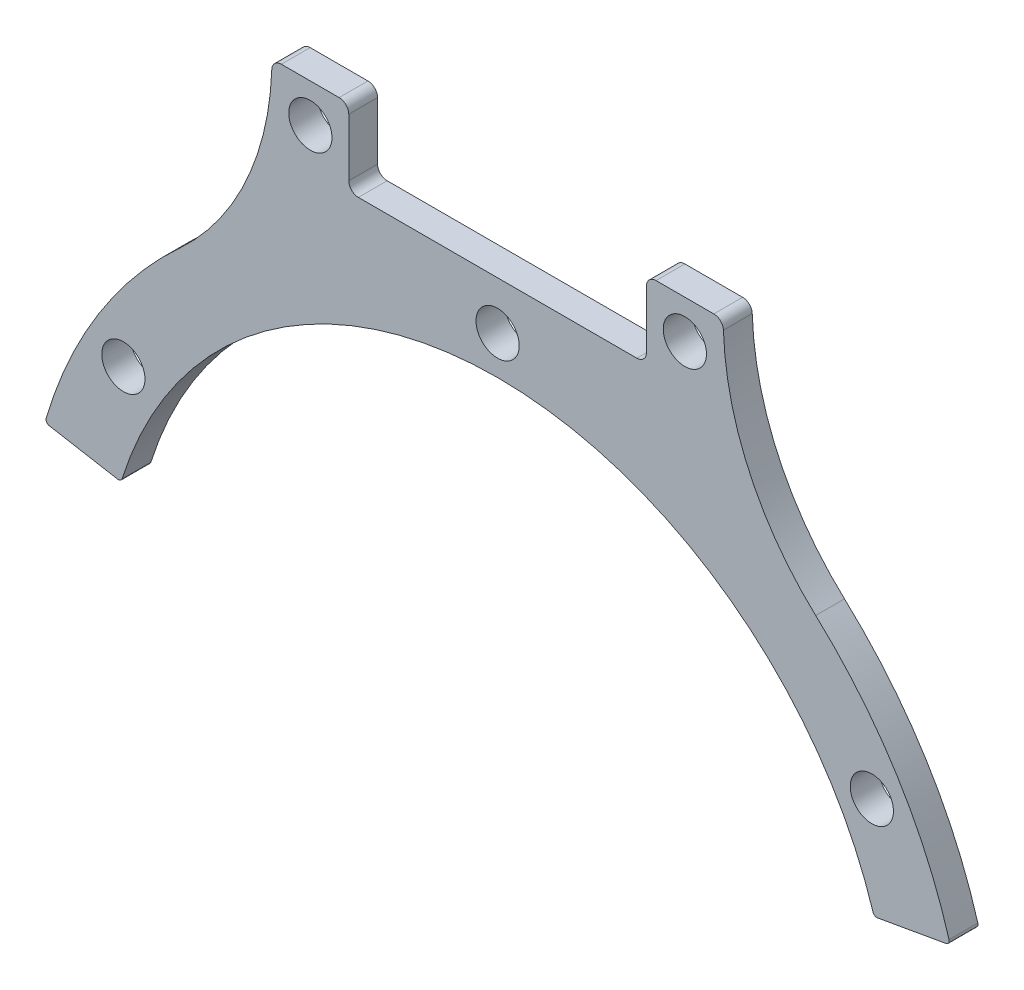
from build123d import *

# Parameters (mm, degrees)
SKETCH_1_R      = 2.25
EXTRUDE_1_DEPTH = 3


with BuildPart() as part:
    # 草图1 → 凸台-拉伸1 (new body)
    with BuildSketch(Plane(origin=(0, 0, 0), x_dir=(-1, 0, 0), z_dir=(0, 0, -1))):
        with BuildLine():
            Line((-46.697056051, -46.688916039), (-39.554488655, -47.948343383))
            ThreePointArc((-39.554488655, -47.948343383), (-39.277504317, -47.896375463), (-39.103531516, -47.674667428))
            ThreePointArc((-39.103531516, -47.674667428), (0, -19), (39.103531516, -47.674667428))
            ThreePointArc((39.103531516, -47.674667428), (39.277504317, -47.896375463), (39.554488655, -47.948343383))
            Line((39.554488655, -47.948343383), (46.697056051, -46.688916039))
            ThreePointArc((46.697056051, -46.688916039), (46.967515904, -46.505836455), (47.011363008, -46.182194526))
            ThreePointArc((47.011363008, -46.182194526), (41.589384656, -34.090096798), (33.125428162, -23.893130722))
            ThreePointArc((33.125428162, -23.893130722), (26.210916767, -14.399107105), (23.515754966, -2.967438148))
            ThreePointArc((23.515754966, -2.967438148), (23.211784398, -2.281473086), (22.516285244, -2))
            Line((22.516285244, -2), (16.5, -2))
            ThreePointArc((16.5, -2), (15.792893219, -2.292893219), (15.5, -3))
            Line((15.5, -3), (15.5, -9))
            ThreePointArc((15.5, -9), (15.207106781, -9.707106781), (14.5, -10))
            Line((14.5, -10), (-14.5, -10))
            ThreePointArc((-14.5, -10), (-15.207106781, -9.707106781), (-15.5, -9))
            Line((-15.5, -9), (-15.5, -3))
            ThreePointArc((-15.5, -3), (-15.792893219, -2.292893219), (-16.5, -2))
            Line((-16.5, -2), (-22.516285244, -2))
            ThreePointArc((-22.516285244, -2), (-23.211784398, -2.281473086), (-23.515754966, -2.967438148))
            ThreePointArc((-23.515754966, -2.967438148), (-26.210916767, -14.399107105), (-33.125428162, -23.893130722))
            ThreePointArc((-33.125428162, -23.893130722), (-41.589384656, -34.090096798), (-47.011363008, -46.182194526))
            ThreePointArc((-47.011363008, -46.182194526), (-46.967515904, -46.505836455), (-46.697056051, -46.688916039))
        make_face()
        with Locations(Location((-38.97114317, -37.5, 0), (0, 0, 180))):
            Circle(SKETCH_1_R, mode=Mode.SUBTRACT)
        with Locations(Location((19.5, -6, 0), (0, 0, 180))):
            Circle(SKETCH_1_R, mode=Mode.SUBTRACT)
        with Locations(Location((38.97114317, -37.5, 0), (0, 0, 180))):
            Circle(SKETCH_1_R, mode=Mode.SUBTRACT)
        with Locations(Location((0, -15, 0), (0, 0, 180))):
            Circle(SKETCH_1_R, mode=Mode.SUBTRACT)
        with Locations(Location((-19.5, -6, 0), (0, 0, 180))):
            Circle(SKETCH_1_R, mode=Mode.SUBTRACT)
    extrude(amount=-EXTRUDE_1_DEPTH)


solid = part.part
